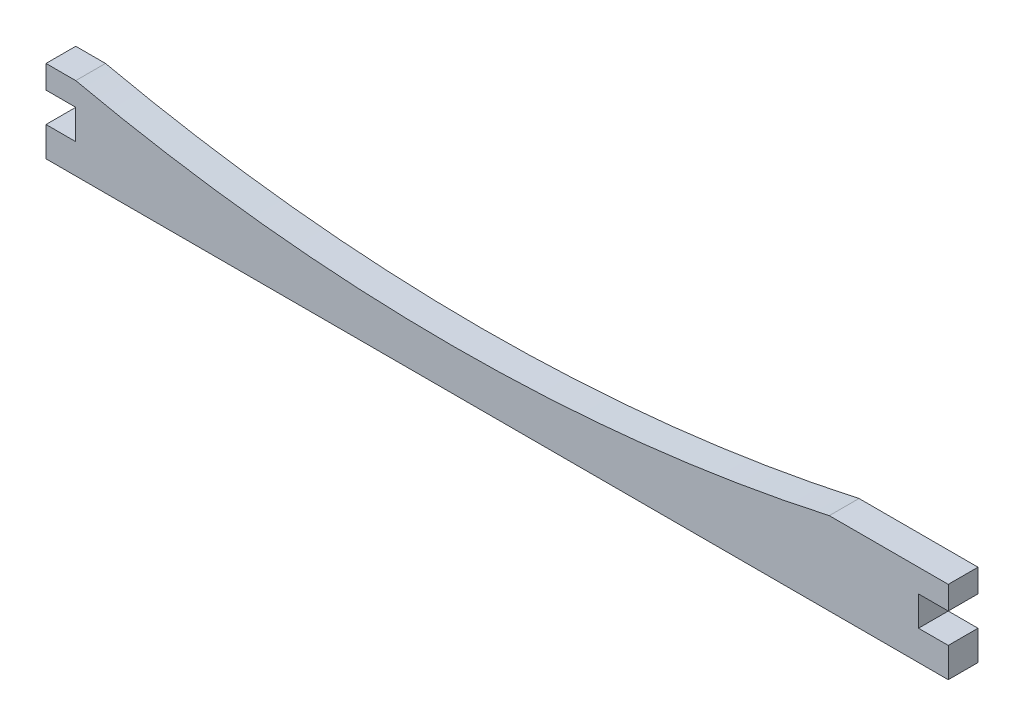
from build123d import *

# Parameters (mm, degrees)
BOSS_EXTRUDE2_DEPTH = 9
SKETCH2_W           = 9
SKETCH2_H           = 9
CUT_EXTRUDE1_DEPTH  = 126.837196409
BOSS_EXTRUDE3_DEPTH = 9


with BuildPart() as part:
    # Sketch1 → Boss-Extrude2 (new body)
    with BuildSketch(Plane.XY):
        with BuildLine():
            Line((-123, 25), (-123, 0))
            Line((-123, 0), (123, 0))
            Line((123, 0), (123, 25))
            Line((123, 25), (114, 25))
            ThreePointArc((114, 25), (0, 12.5), (-114, 25))
            Line((-114, 25), (-123, 25))
        make_face()
    extrude(amount=BOSS_EXTRUDE2_DEPTH)

    # Sketch2 → Cut-Extrude1 (cut, through all)
    with BuildSketch(Plane.XY):
        with Locations((118.5, 13.5)):
            Rectangle(SKETCH2_W, SKETCH2_H)
        with Locations((-118.5, 13.5)):
            Rectangle(SKETCH2_W, SKETCH2_H)
    extrude(amount=CUT_EXTRUDE1_DEPTH, mode=Mode.SUBTRACT)

    # Sketch3 → Boss-Extrude3 (add)
    with BuildSketch(Plane.XY):
        Polygon((114, 25), (114, 0), (150, 0), (150, 9), (141, 9), (141, 18), (150, 18), (150, 25), align=None)
    extrude(amount=BOSS_EXTRUDE3_DEPTH)


solid = part.part
